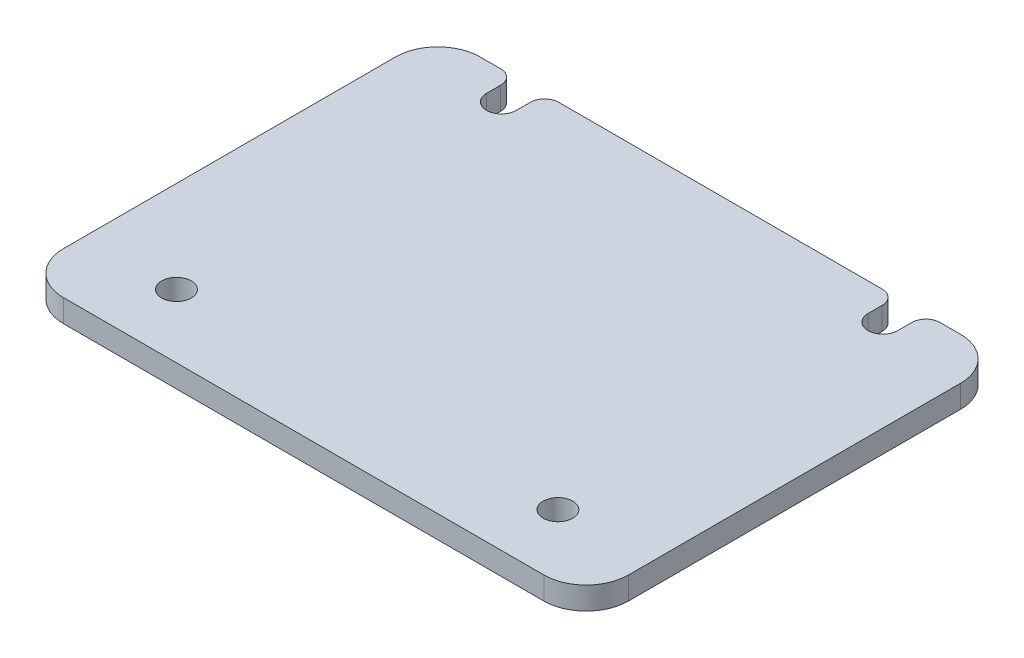
from build123d import *

# Parameters (mm, degrees)
SKETCH1_W                = 40
SKETCH1_H                = 29.5
BOSS_EXTRUDE1_DEPTH      = 1.6
FILLET1_R                = 3
M2_CLEARANCE_HOLE3_D     = 2.1
M2_CLEARANCE_HOLE3_DEPTH = 5.2
M2_CLEARANCE_HOLE3_TIP   = 0.63090365
CUT_EXTRUDE2_DEPTH       = 25.902258934
CUT_EXTRUDE2_DEPTH_BACK  = 25.902258934
FILLET3_R                = 1


with BuildPart() as part:
    # Sketch1 → Boss-Extrude1 (new body)
    with BuildSketch(Plane(origin=(0, 0, 0), x_dir=(1, 0, 0), z_dir=(0, 1, 0))):
        Rectangle(SKETCH1_W, SKETCH1_H)
    extrude(amount=BOSS_EXTRUDE1_DEPTH)

    # Fillet1
    fillet1_edges = [part.edges().sort_by_distance(p)[0] for p in [
        (20, 0.8, -14.75),
        (20, 0.8, 14.75),
        (-20, 0.8, 14.75),
        (-20, 0.8, -14.75),
    ]]
    fillet(fillet1_edges, radius=FILLET1_R)

    # M2 Clearance Hole3
    with Locations(Plane(origin=(0, 1.6, 0), x_dir=(1, 0, 0), z_dir=(0, 1, 0))):
        with Locations((-13.5, 12.75), (13.5, 12.75), (13.5, -10.25), (-13.5, -10.25)):
            Hole(M2_CLEARANCE_HOLE3_D / 2, depth=M2_CLEARANCE_HOLE3_DEPTH)
            with Locations((0, 0, -(M2_CLEARANCE_HOLE3_DEPTH + M2_CLEARANCE_HOLE3_TIP / 2))):  # 118° drill point
                Cone(0, M2_CLEARANCE_HOLE3_D / 2, M2_CLEARANCE_HOLE3_TIP, mode=Mode.SUBTRACT)

    # Sketch10 → Cut-Extrude2 (cut, two sides: drawn at the far end of the back side and taken through both)
    with BuildSketch(Plane(origin=(0, 1.6, 0), x_dir=(1, 0, 0), z_dir=(0, 1, 0)).offset(-CUT_EXTRUDE2_DEPTH_BACK)):
        with BuildLine():
            Line((-14.55, 12.75), (-14.55, 17.75))
            ThreePointArc((-14.55, 17.75), (-13.5, 18.8), (-12.45, 17.75))
            Line((-12.45, 17.75), (-12.45, 12.75))
            ThreePointArc((-12.45, 12.75), (-13.5, 11.7), (-14.55, 12.75))
        make_face()
        with BuildLine():
            Line((14.55, 12.75), (14.55, 17.75))
            ThreePointArc((14.55, 17.75), (13.5, 18.8), (12.45, 17.75))
            Line((12.45, 17.75), (12.45, 12.75))
            ThreePointArc((12.45, 12.75), (13.5, 11.7), (14.55, 12.75))
        make_face()
    extrude(amount=CUT_EXTRUDE2_DEPTH + CUT_EXTRUDE2_DEPTH_BACK, mode=Mode.SUBTRACT)

    # Fillet3
    fillet3_edges = [part.edges().sort_by_distance(p)[0] for p in [
        (-12.45, 0.8, -14.75),
        (14.55, 0.8, -14.75),
        (12.45, 0.8, -14.75),
        (-14.55, 0.8, -14.75),
    ]]
    fillet(fillet3_edges, radius=FILLET3_R)


solid = part.part
